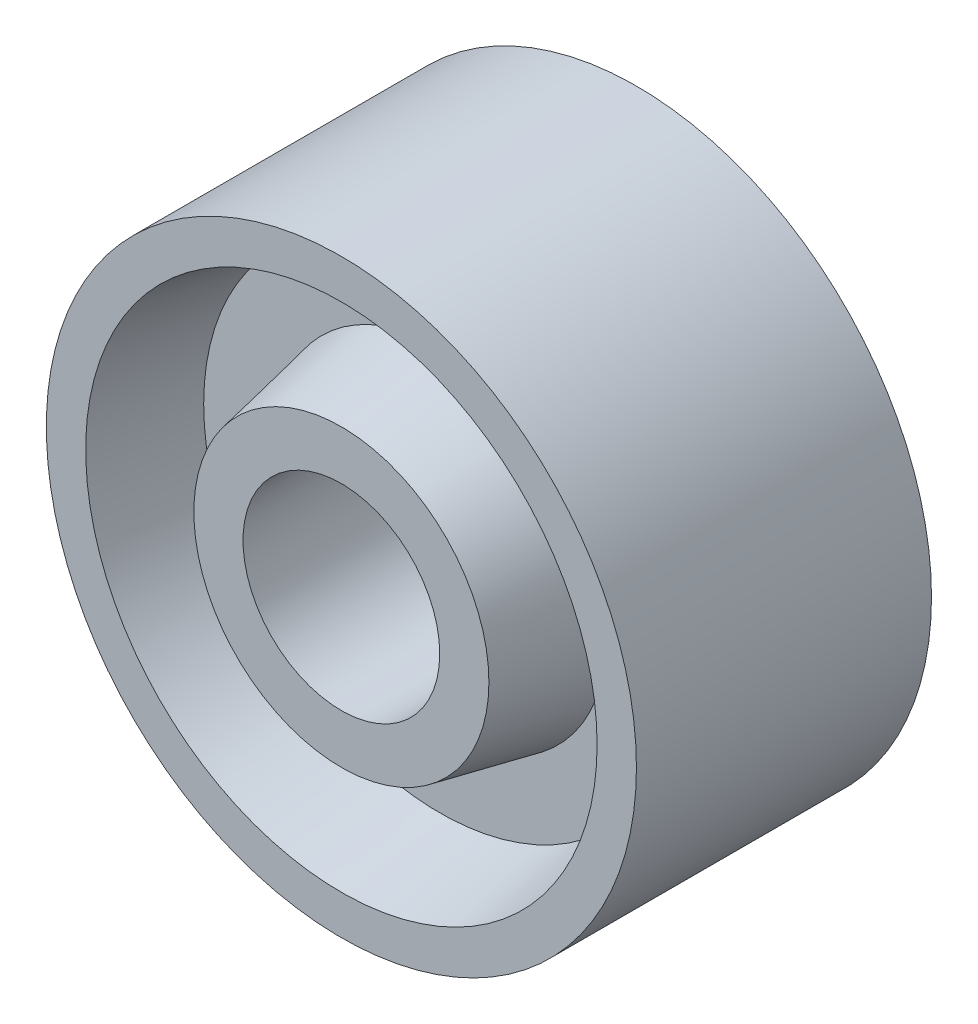
from build123d import *


with BuildPart() as part:
    # Çizim1 → Döndür2 (revolve)
    with BuildSketch(Plane(origin=(0, 0, 0), x_dir=(0, 0, -1), z_dir=(1, 0, 0)), mode=Mode.PRIVATE) as d_nd_r2_sk:
        Polygon((-4.929577465, 10), (25.070422535, 10), (25.070422535, 15), (15.070422535, 17), (15.070422535, 24), (25.070422535, 26), (25.070422535, 30), (-4.929577465, 30), (-4.929577465, 26), (5.070422535, 24), (5.070422535, 17), (-4.929577465, 15), align=None)
    revolve(d_nd_r2_sk.sketch.rotate(Axis((0, 0, 34.929577465), (0, 0, -1)), 90), axis=Axis((0, 0, 34.929577465), (0, 0, -1)))


solid = part.part
